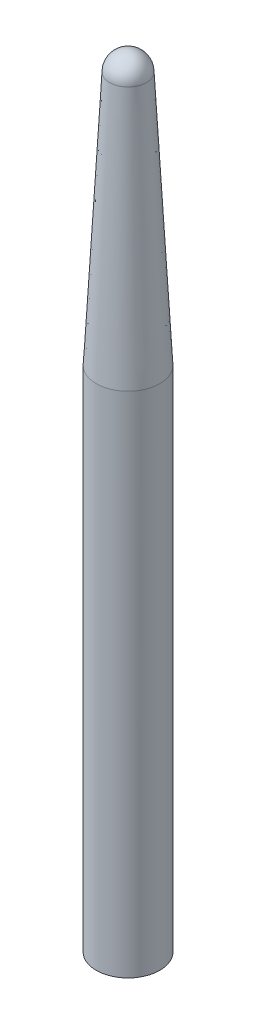
from build123d import *

# Parameters (mm, degrees)
SKETCH1_R                   = 4.7625
BOSS_EXTRUDE1_DEPTH         = 76.2
SKETCH2_R                   = 4.7625
BOSS_EXTRUDE2_DEPTH         = 38.1
BOSS_EXTRUDE2_TAPER         = 3
F_1_4_28_TAPPED_HOLE1_D     = 5.4102
F_1_4_28_TAPPED_HOLE1_DEPTH = 7.874
F_1_4_28_TAPPED_HOLE1_TIP   = 1.625388061


with BuildPart() as part:
    # Sketch1 → Boss-Extrude1 (new body)
    with BuildSketch(Plane(origin=(0, 0, 0), x_dir=(1, 0, 0), z_dir=(0, 1, 0))):
        with Locations(Location((0, 0, 0), (0, 0, 90))):
            Circle(SKETCH1_R)
    extrude(amount=BOSS_EXTRUDE1_DEPTH)

    # Sketch2 → Boss-Extrude2 (add)
    with BuildSketch(Plane(origin=(0, 76.2, 0), x_dir=(1, 0, 0), z_dir=(0, 1, 0))):
        with Locations(Location((0, 0, 0), (0, 0, 90))):
            Circle(SKETCH2_R)
    extrude(amount=BOSS_EXTRUDE2_DEPTH, taper=BOSS_EXTRUDE2_TAPER)

    # Sketch3 → Revolve1 (revolve)
    with BuildSketch(Plane(origin=(0, 114.3, 0), x_dir=(1, 0, 0), z_dir=(0, 1, 0))):
        with BuildLine():
            Line((0, 2.765763609), (0, -2.765763609))
            ThreePointArc((0, -2.765763609), (2.765763609, 0), (0, 2.765763609))
        make_face()
    revolve(axis=Axis((0, 114.3, -2.765763609), (0, 0, 1)))

    # 1/4-28 Tapped Hole1
    with Locations(Plane.XZ):
        with Locations((0, 0)):
            Hole(F_1_4_28_TAPPED_HOLE1_D / 2, depth=F_1_4_28_TAPPED_HOLE1_DEPTH)
            with Locations((0, 0, -(F_1_4_28_TAPPED_HOLE1_DEPTH + F_1_4_28_TAPPED_HOLE1_TIP / 2))):  # 118° drill point
                Cone(0, F_1_4_28_TAPPED_HOLE1_D / 2, F_1_4_28_TAPPED_HOLE1_TIP, mode=Mode.SUBTRACT)


solid = part.part
